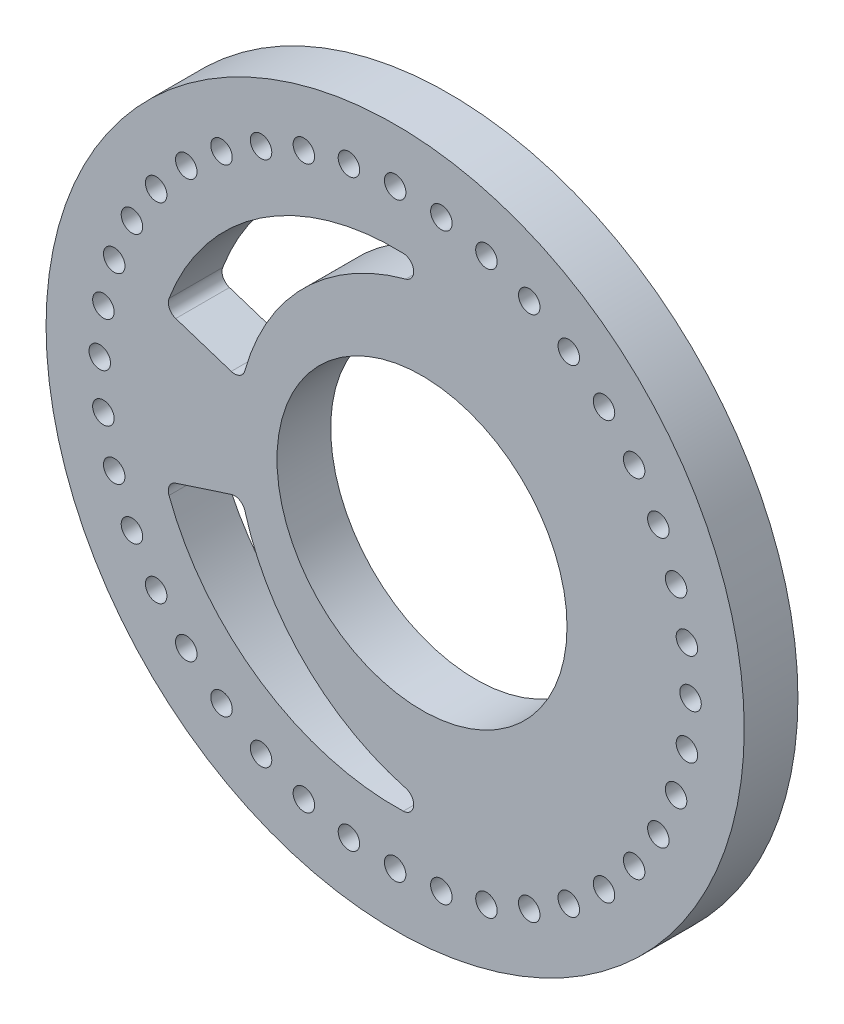
from build123d import *

# Parameters (mm, degrees)
SKETCH_5_R      = 65
SKETCH_5_R_2    = 2
SKETCH_5_R_3    = 27
EXTRUDE_3_DEPTH = 10
FILLET_1_R      = 2


with BuildPart() as part:
    # 草图5 → 凸台-拉伸3 (new body)
    with BuildSketch(Plane.XY):
        Circle(SKETCH_5_R)
        with Locations((55, 0)):
            Circle(SKETCH_5_R_2, mode=Mode.SUBTRACT)
        with Locations((54.322858733, -8.603895577)):
            Circle(SKETCH_5_R_2, mode=Mode.SUBTRACT)
        with Locations((52.308108396, -16.995934691)):
            Circle(SKETCH_5_R_2, mode=Mode.SUBTRACT)
        with Locations((49.00535883, -24.969477486)):
            Circle(SKETCH_5_R_2, mode=Mode.SUBTRACT)
        with Locations((44.495934691, -32.328188876)):
            Circle(SKETCH_5_R_2, mode=Mode.SUBTRACT)
        with Locations((38.890872965, -38.890872965)):
            Circle(SKETCH_5_R_2, mode=Mode.SUBTRACT)
        with Locations((32.328188876, -44.495934691)):
            Circle(SKETCH_5_R_2, mode=Mode.SUBTRACT)
        with Locations((24.969477486, -49.00535883)):
            Circle(SKETCH_5_R_2, mode=Mode.SUBTRACT)
        with Locations((16.995934691, -52.308108396)):
            Circle(SKETCH_5_R_2, mode=Mode.SUBTRACT)
        with Locations((8.603895577, -54.322858733)):
            Circle(SKETCH_5_R_2, mode=Mode.SUBTRACT)
        with Locations((0, -55)):
            Circle(SKETCH_5_R_2, mode=Mode.SUBTRACT)
        with Locations((-8.603895577, -54.322858733)):
            Circle(SKETCH_5_R_2, mode=Mode.SUBTRACT)
        with Locations((-16.995934691, -52.308108396)):
            Circle(SKETCH_5_R_2, mode=Mode.SUBTRACT)
        with Locations((-24.969477486, -49.00535883)):
            Circle(SKETCH_5_R_2, mode=Mode.SUBTRACT)
        with Locations((-32.328188876, -44.495934691)):
            Circle(SKETCH_5_R_2, mode=Mode.SUBTRACT)
        with Locations((-38.890872965, -38.890872965)):
            Circle(SKETCH_5_R_2, mode=Mode.SUBTRACT)
        with Locations((-44.495934691, -32.328188876)):
            Circle(SKETCH_5_R_2, mode=Mode.SUBTRACT)
        with Locations((-49.00535883, -24.969477486)):
            Circle(SKETCH_5_R_2, mode=Mode.SUBTRACT)
        with Locations((-52.308108396, -16.995934691)):
            Circle(SKETCH_5_R_2, mode=Mode.SUBTRACT)
        with Locations((-54.322858733, -8.603895577)):
            Circle(SKETCH_5_R_2, mode=Mode.SUBTRACT)
        with Locations((-55, 0)):
            Circle(SKETCH_5_R_2, mode=Mode.SUBTRACT)
        with Locations((-54.322858733, 8.603895577)):
            Circle(SKETCH_5_R_2, mode=Mode.SUBTRACT)
        with Locations((-52.308108396, 16.995934691)):
            Circle(SKETCH_5_R_2, mode=Mode.SUBTRACT)
        with Locations((-49.00535883, 24.969477486)):
            Circle(SKETCH_5_R_2, mode=Mode.SUBTRACT)
        with Locations((-44.495934691, 32.328188876)):
            Circle(SKETCH_5_R_2, mode=Mode.SUBTRACT)
        with Locations((-38.890872965, 38.890872965)):
            Circle(SKETCH_5_R_2, mode=Mode.SUBTRACT)
        with Locations((-32.328188876, 44.495934691)):
            Circle(SKETCH_5_R_2, mode=Mode.SUBTRACT)
        with Locations((-24.969477486, 49.00535883)):
            Circle(SKETCH_5_R_2, mode=Mode.SUBTRACT)
        with Locations((-16.995934691, 52.308108396)):
            Circle(SKETCH_5_R_2, mode=Mode.SUBTRACT)
        with Locations((-8.603895577, 54.322858733)):
            Circle(SKETCH_5_R_2, mode=Mode.SUBTRACT)
        with Locations((0, 55)):
            Circle(SKETCH_5_R_2, mode=Mode.SUBTRACT)
        with Locations((8.603895577, 54.322858733)):
            Circle(SKETCH_5_R_2, mode=Mode.SUBTRACT)
        with Locations((16.995934691, 52.308108396)):
            Circle(SKETCH_5_R_2, mode=Mode.SUBTRACT)
        with Locations((24.969477486, 49.00535883)):
            Circle(SKETCH_5_R_2, mode=Mode.SUBTRACT)
        with Locations((32.328188876, 44.495934691)):
            Circle(SKETCH_5_R_2, mode=Mode.SUBTRACT)
        with Locations((38.890872965, 38.890872965)):
            Circle(SKETCH_5_R_2, mode=Mode.SUBTRACT)
        with Locations((44.495934691, 32.328188876)):
            Circle(SKETCH_5_R_2, mode=Mode.SUBTRACT)
        with Locations((49.00535883, 24.969477486)):
            Circle(SKETCH_5_R_2, mode=Mode.SUBTRACT)
        with Locations((52.308108396, 16.995934691)):
            Circle(SKETCH_5_R_2, mode=Mode.SUBTRACT)
        with Locations((54.322858733, 8.603895577)):
            Circle(SKETCH_5_R_2, mode=Mode.SUBTRACT)
        with Locations((5, 0)):
            Circle(SKETCH_5_R_3, mode=Mode.SUBTRACT)
        with BuildLine():
            Line((-42.797543233, 13.905764747), (-28.480319158, 9.253816649))
            ThreePointArc((-28.480319158, 9.253816649), (-12.826252178, 33.752847264), (14.913461538, 42.456903619))
            ThreePointArc((14.913461538, 42.456903619), (-19.954257333, 40.333951136), (-42.797543233, 13.905764747))
        make_face(mode=Mode.SUBTRACT)
        with BuildLine():
            Line((-42.797543233, -13.905764747), (-28.480319158, -9.253816649))
            ThreePointArc((-28.480319158, -9.253816649), (-12.826252178, -33.752847264), (14.913461538, -42.456903619))
            ThreePointArc((14.913461538, -42.456903619), (-19.954257333, -40.333951136), (-42.797543233, -13.905764747))
        make_face(mode=Mode.SUBTRACT)
    extrude(amount=EXTRUDE_3_DEPTH)

    # 圆角1
    fillet_1_edges = [part.edges().sort_by_distance(p)[0] for p in [
        (-42.797543233, 13.905764747, 5),
        (-28.480319158, 9.253816649, 5),
        (14.913461538, 42.456903619, 5),
        (-28.480319158, -9.253816649, 5),
        (-42.797543233, -13.905764747, 5),
        (14.913461538, -42.456903619, 5),
    ]]
    fillet(fillet_1_edges, radius=FILLET_1_R)


solid = part.part
